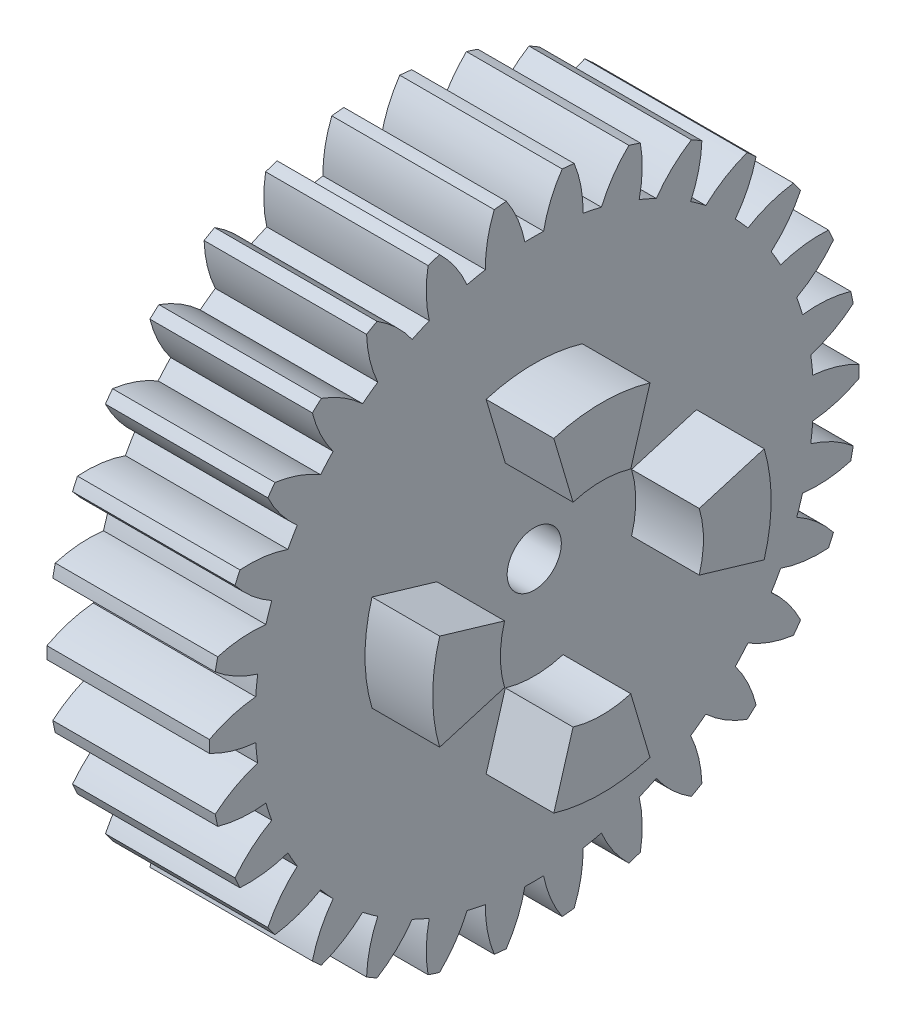
from build123d import *

# Parameters (mm, degrees)
BASPROSKE_W     = 12
BASPROSKE_H     = 24
TOOTHCUT_DEPTH  = 37
TEETHCUTS_COUNT = 30
TEETHCUTS_ANGLE = 348
BORSKE_R        = 2
BORE_DEPTH      = 50.0000508
EXTRUDE_1_DEPTH = 5


with BuildPart() as part:
    # BasProSke → Base-Revolve (revolve)
    with BuildSketch(Plane(origin=(0, 0, 0), x_dir=(1, 0, 0), z_dir=(0, 1, 0)), mode=Mode.PRIVATE) as base_revolve_sk:
        with Locations((6, 12)):
            Rectangle(BASPROSKE_W, BASPROSKE_H)
    revolve(base_revolve_sk.sketch.rotate(Axis((-10, 0, 0), (1, 0, 0)), 180), axis=Axis((-10, 0, 0), (1, 0, 0)))

    # TooCutSke → ToothCut (cut, through all)
    with BuildSketch(Plane(origin=(0, 0, 0), x_dir=(0, 0, -1), z_dir=(1, 0, 0))):
        with BuildLine():
            ThreePointArc((0.693278797, 20.612344372), (0, 20.624), (-0.693278797, 20.612344372))
            ThreePointArc((-0.693278797, 20.612344372), (-1.219042225, 22.34383125), (-2.080549663, 23.935144835))
            ThreePointArc((-2.080549663, 23.935144835), (0, 24.0254), (2.080549663, 23.935144835))
            ThreePointArc((2.080549663, 23.935144835), (1.219042225, 22.34383125), (0.693278797, 20.612344372))
        make_face()
    toothcut = extrude(amount=TOOTHCUT_DEPTH, mode=Mode.SUBTRACT)

    # TeethCuts: ToothCut ×30 about axis
    teethcuts_axis = Axis((-10, 0, 0), (1, 0, 0))
    for i in range(1, TEETHCUTS_COUNT):
        add(toothcut.rotate(teethcuts_axis, i * TEETHCUTS_ANGLE / (TEETHCUTS_COUNT - 1)), mode=Mode.SUBTRACT)

    # BorSke → Bore (cut, symmetric)
    with BuildSketch(Plane(origin=(0, 0, 0), x_dir=(0, 0, -1), z_dir=(1, 0, 0))):
        with Locations(Location((0, 0, 0), (0, 0, 180))):
            Circle(BORSKE_R)
    extrude(amount=BORE_DEPTH, both=True, mode=Mode.SUBTRACT)

    # 草图1 → 凸台-拉伸1 (add)
    with BuildSketch(Plane(origin=(12, 0, 0), x_dir=(0, 0, -1), z_dir=(1, 0, 0))):
        with BuildLine():
            Line((-2.13181457, 7.190644383), (-3.553024283, 11.984407305))
            ThreePointArc((-3.553024283, 11.984407305), (0, 12.5), (3.553024283, 11.984407305))
            Line((3.553024283, 11.984407305), (2.13181457, 7.190644383))
            ThreePointArc((2.13181457, 7.190644383), (0, 7.5), (-2.13181457, 7.190644383))
        make_face()
        with BuildLine():
            Line((7.190644383, 2.13181457), (11.984407305, 3.553024283))
            ThreePointArc((11.984407305, 3.553024283), (12.5, 0), (11.984407305, -3.553024283))
            Line((11.984407305, -3.553024283), (7.190644383, -2.13181457))
            ThreePointArc((7.190644383, -2.13181457), (7.5, 0), (7.190644383, 2.13181457))
        make_face()
        with BuildLine():
            Line((2.13181457, -7.190644383), (3.553024283, -11.984407305))
            ThreePointArc((3.553024283, -11.984407305), (0, -12.5), (-3.553024283, -11.984407305))
            Line((-3.553024283, -11.984407305), (-2.13181457, -7.190644383))
            ThreePointArc((-2.13181457, -7.190644383), (0, -7.5), (2.13181457, -7.190644383))
        make_face()
        with BuildLine():
            Line((-7.190644383, -2.13181457), (-11.984407305, -3.553024283))
            ThreePointArc((-11.984407305, -3.553024283), (-12.5, 0), (-11.984407305, 3.553024283))
            Line((-11.984407305, 3.553024283), (-7.190644383, 2.13181457))
            ThreePointArc((-7.190644383, 2.13181457), (-7.5, 0), (-7.190644383, -2.13181457))
        make_face()
    extrude(amount=EXTRUDE_1_DEPTH)


solid = part.part
